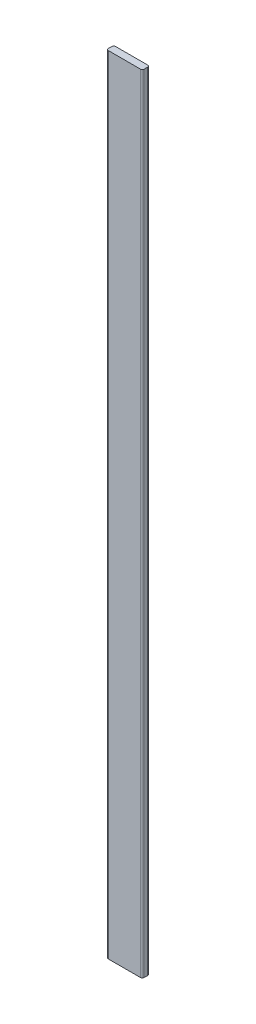
from build123d import *

# Parameters (mm, degrees)
SKETCH_1_W      = 100
SKETCH_1_H      = 2200
EXTRUDE_1_DEPTH = 20
FILLET_1_R      = 5


with BuildPart() as part:
    # Эскиз1 → Бобышка-Вытянуть1 (new body)
    with BuildSketch(Plane.XY):
        with Locations((-331.578947368, 1027.631578947)):
            Rectangle(SKETCH_1_W, SKETCH_1_H)
    extrude(amount=EXTRUDE_1_DEPTH)

    # Скругление1
    fillet_1_edges = [part.edges().sort_by_distance(p)[0] for p in [
        (-281.578947368, 1027.631578947, 20),
        (-381.578947368, 1027.631578947, 20),
        (-281.578947368, 1027.631578947, 0),
        (-381.578947368, 1027.631578947, 0),
    ]]
    fillet(fillet_1_edges, radius=FILLET_1_R)


solid = part.part
